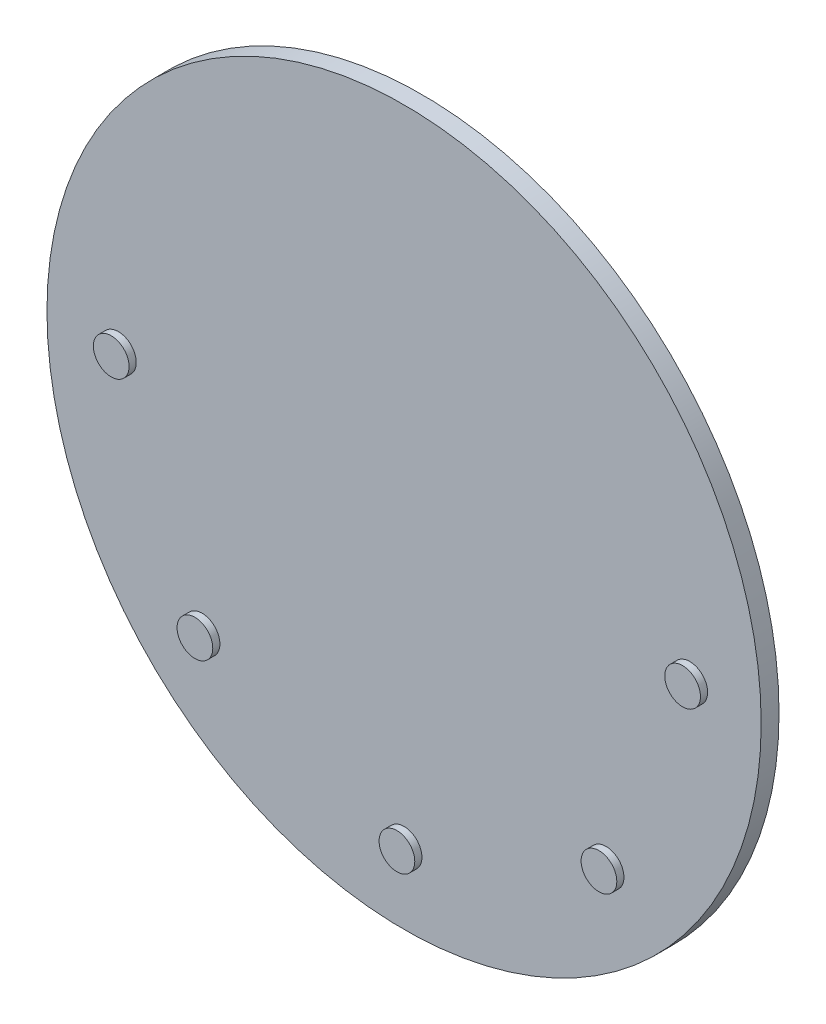
from build123d import *

# Parameters (mm, degrees)
SKETCH_1_R           = 100
EXTRUDE_1_DEPTH      = 5
EXTRUDE_2_DEPTH      = 2
EXTRUDE_2_DEPTH_BACK = 7
SKETCH_2_R           = 5


with BuildPart() as part:
    # Эскиз1 → Бобышка-Вытянуть1 (new body)
    with BuildSketch(Plane.XY):
        Circle(SKETCH_1_R)
    extrude(amount=EXTRUDE_1_DEPTH)

    # Эскиз2 → Бобышка-Вытянуть2 (add, two sides: drawn at the far end of the back side and taken through both)
    with BuildSketch(Plane.XY.offset(5).offset(-EXTRUDE_2_DEPTH_BACK)):
        with Locations((-80, 0)):
            Circle(SKETCH_2_R)
        with Locations((-56.568542495, -56.568542495)):
            Circle(SKETCH_2_R)
        with Locations((0, -80)):
            Circle(SKETCH_2_R)
        with Locations((56.568542495, -56.568542495)):
            Circle(SKETCH_2_R)
        with Locations((80, 0)):
            Circle(SKETCH_2_R)
    extrude(amount=EXTRUDE_2_DEPTH + EXTRUDE_2_DEPTH_BACK)


solid = part.part
